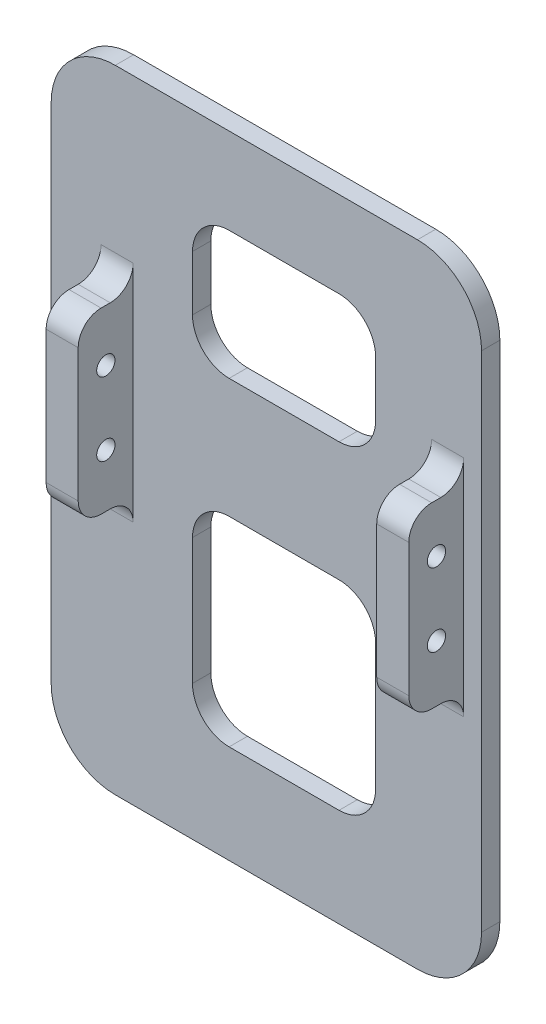
from build123d import *

# Parameters (mm, degrees)
SKETCH1_W           = 47
SKETCH1_H           = 69
BOSS_EXTRUDE1_DEPTH = 2
FILLET1_R           = 7
SKETCH2_W           = 20
SKETCH2_H           = 14
SKETCH2_H_2         = 21.8
CUT_EXTRUDE1_DEPTH  = 2
SKETCH3_W           = 3.5
SKETCH3_H           = 19.5
BOSS_EXTRUDE2_DEPTH = 6
FILLET2_R           = 4
FILLET3_R           = 2.5
SKETCH4_R           = 1
CUT_EXTRUDE2_DEPTH  = 444.714975323


with BuildPart() as part:
    # Sketch1 → Boss-Extrude1 (new body)
    with BuildSketch(Plane.XY.offset(10)):
        with Locations((-239.856711142, 406.898341584)):
            Rectangle(SKETCH1_W, SKETCH1_H)
    extrude(amount=BOSS_EXTRUDE1_DEPTH)

    # Fillet1
    fillet1_edges = [part.edges().sort_by_distance(p)[0] for p in [
        (-263.356711142, 441.398341584, 11),
        (-216.356711142, 441.398341584, 11),
        (-216.356711142, 372.398341584, 11),
        (-263.356711142, 372.398341584, 11),
    ]]
    fillet(fillet1_edges, radius=FILLET1_R)

    # Sketch2 → Cut-Extrude1 (cut)
    with BuildSketch(Plane.XY.offset(12)):
        with Locations((-237.923586614, 425.007047567)):
            Rectangle(SKETCH2_W, SKETCH2_H)
        with Locations((-237.923586614, 394.052620238)):
            Rectangle(SKETCH2_W, SKETCH2_H_2)
    extrude(amount=-CUT_EXTRUDE1_DEPTH, mode=Mode.SUBTRACT)

    # Sketch3 → Boss-Extrude2 (add)
    with BuildSketch(Plane.XY.offset(12)):
        with Locations((-220.053070068, 411.047943115)):
            Rectangle(SKETCH3_W, SKETCH3_H)
        with Locations((-256.157684326, 411.411865234)):
            Rectangle(SKETCH3_W, SKETCH3_H)
    extrude(amount=BOSS_EXTRUDE2_DEPTH)

    # Fillet2
    fillet2_edges = [part.edges().sort_by_distance(p)[0] for p in [
        (-247.923586614, 418.007047567, 11),
        (-247.923586614, 432.007047567, 11),
        (-227.923586614, 432.007047567, 11),
        (-227.923586614, 418.007047567, 11),
        (-247.923586614, 383.152620238, 11),
        (-247.923586614, 404.952620238, 11),
        (-227.923586614, 404.952620238, 11),
        (-227.923586614, 383.152620238, 11),
    ]]
    fillet(fillet2_edges, radius=FILLET2_R)

    # Fillet3
    fillet3_edges = [part.edges().sort_by_distance(p)[0] for p in [
        (-256.157684326, 421.161865234, 12),
        (-256.157684326, 401.661865234, 12),
        (-256.157684326, 421.161865234, 18),
        (-256.157684326, 401.661865234, 18),
        (-220.053070068, 401.297943115, 12),
        (-220.053070068, 420.797943115, 12),
        (-220.053070068, 401.297943115, 18),
        (-220.053070068, 420.797943115, 18),
    ]]
    fillet(fillet3_edges, radius=FILLET3_R)

    # Sketch4 → Cut-Extrude2 (cut, through all)
    with BuildSketch(Plane.ZY.offset(257.907684326)):
        with Locations((14.979375571, 415.479440957)):
            Circle(SKETCH4_R)
        with Locations((14.978983816, 407.479440966)):
            Circle(SKETCH4_R)
    extrude(amount=-CUT_EXTRUDE2_DEPTH, mode=Mode.SUBTRACT)


solid = part.part
